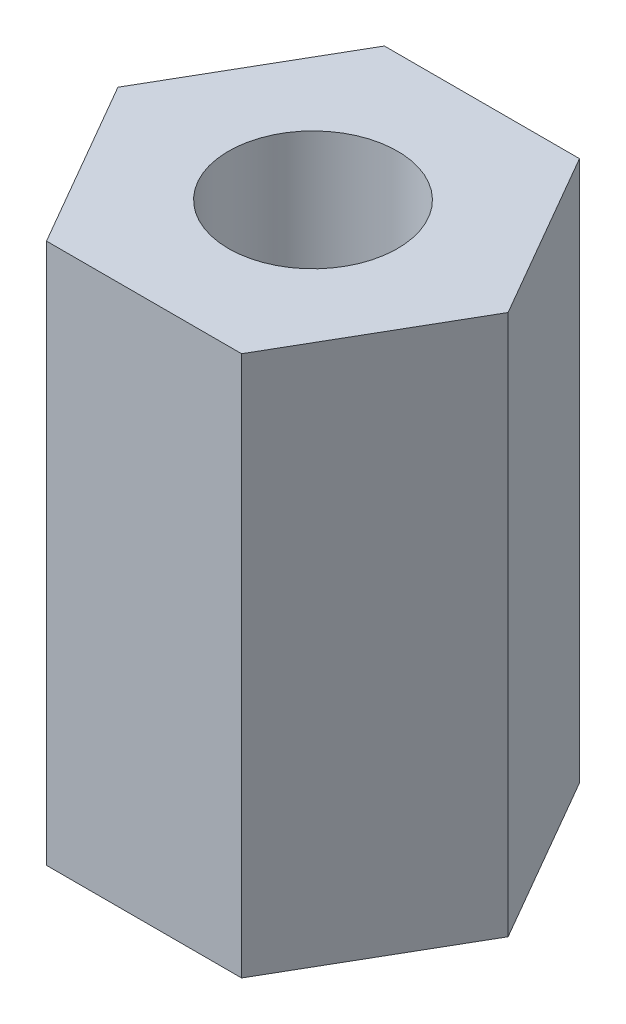
from build123d import *

# Parameters (mm, degrees)
SKETCH_1_R      = 1.25
EXTRUDE_1_DEPTH = 8


with BuildPart() as part:
    # 草图1 → 凸台-拉伸1 (new body)
    with BuildSketch(Plane(origin=(0, 0, 0), x_dir=(1, 0, 0), z_dir=(0, 1, 0))):
        Polygon((1.443375673, -2.5), (2.886751346, 0), (1.443375673, 2.5), (-1.443375673, 2.5), (-2.886751346, 0), (-1.443375673, -2.5), align=None)
        with Locations(Location((0, 0, 0), (0, 0, 270))):
            Circle(SKETCH_1_R, mode=Mode.SUBTRACT)
    extrude(amount=EXTRUDE_1_DEPTH)


solid = part.part
